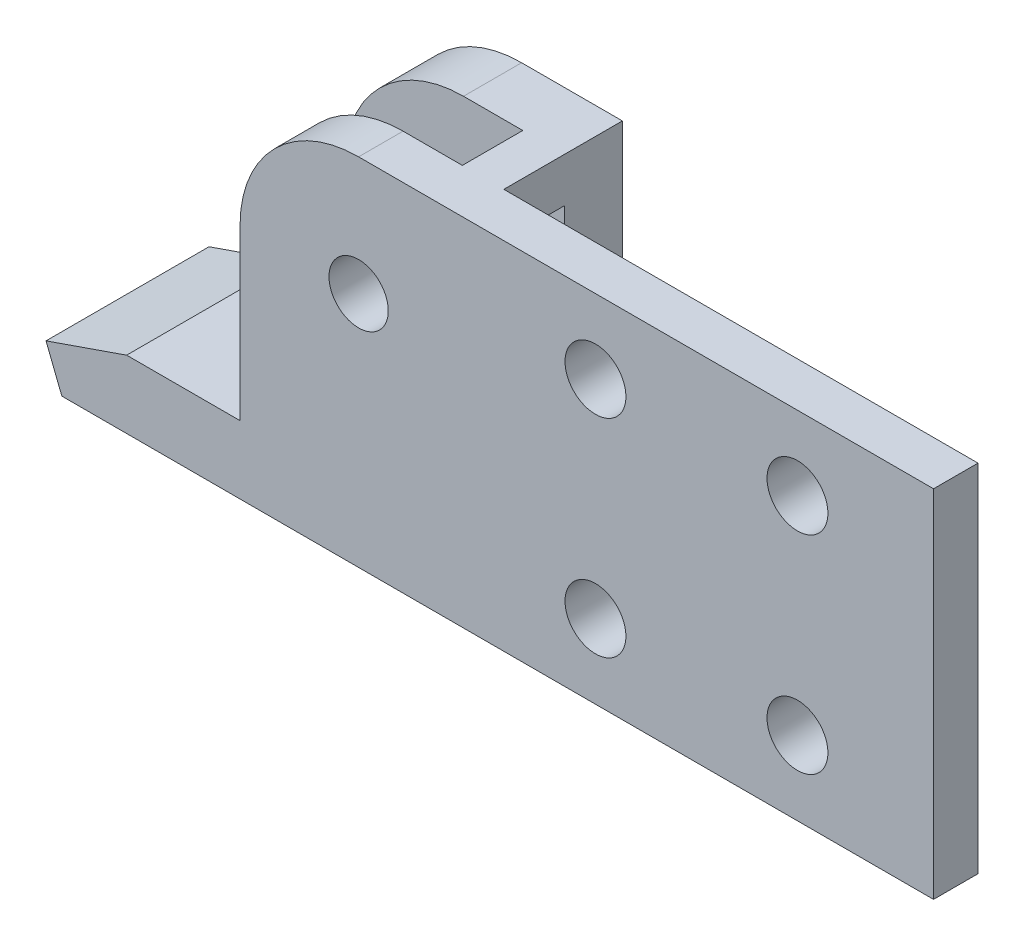
from build123d import *

# Parameters (mm, degrees)
SKETCH2_R                  = 3.175
BOSS_EXTRUDE1_DEPTH        = 4.7625
BOSS_EXTRUDE2_START        = 12.7
BOSS_EXTRUDE2_DEPTH        = 12.7
SKETCH12_W                 = 6.477
SKETCH12_H                 = 21.856650617
CUT_EXTRUDE1_DEPTH         = 24.13
SKETCH12_3_W               = 6.477
SKETCH12_3_H               = 4.7625
CUT_EXTRUDE2_DEPTH         = 19.05
TAP_DRILL_FOR_10_32_TAP1_D = 4.0386
F_1_4_CLEARANCE_HOLE1_D    = 6.5278


with BuildPart() as part:
    # Sketch2 → Boss-Extrude1 (new body)
    with BuildSketch(Plane.XY):
        with BuildLine():
            Line((-67.986186343, -228.533359856), (-69.686856366, -224.252380141))
            Line((-69.686856366, -224.252380141), (-61.0470258, -221.260552334))
            Line((-61.0470258, -221.260552334), (-48.895, -221.260552334))
            Line((-48.895, -221.260552334), (-48.895, -203.133359856))
            ThreePointArc((-48.895, -203.133359856), (-45.175256121, -194.153103735), (-36.195, -190.433359856))
            Line((-36.195, -190.433359856), (25.4, -190.433359856))
            Line((25.4, -190.433359856), (25.4, -228.533359856))
            Line((25.4, -228.533359856), (-67.986186343, -228.533359856))
        make_face()
        with Locations((-36.195, -203.133359856)):
            Circle(SKETCH2_R, mode=Mode.SUBTRACT)
    extrude(amount=BOSS_EXTRUDE1_DEPTH)

    # Sketch11 → Boss-Extrude2 (add)
    with BuildSketch(Plane(origin=(0, 0, 0), x_dir=(-1, 0, 0), z_dir=(0, 0, -1)).offset(BOSS_EXTRUDE2_START)):
        with BuildLine():
            Line((25.4, -190.433359856), (25.4, -228.533359856))
            Line((25.4, -228.533359856), (67.986186343, -228.533359856))
            Line((67.986186343, -228.533359856), (69.686856366, -224.252380141))
            Line((69.686856366, -224.252380141), (61.0470258, -221.260552334))
            Line((61.0470258, -221.260552334), (48.895, -221.260552334))
            Line((48.895, -221.260552334), (48.895, -203.133359856))
            ThreePointArc((48.895, -203.133359856), (45.175256121, -194.153103735), (36.195, -190.433359856))
            Line((36.195, -190.433359856), (25.4, -190.433359856))
        make_face()
    extrude(amount=-BOSS_EXTRUDE2_DEPTH)

    # Sketch12 → Cut-Extrude1 (cut)
    with BuildSketch(Plane.ZY.offset(48.895)):
        with Locations((-3.2385, -206.124185165)):
            Rectangle(SKETCH12_W, SKETCH12_H)
    extrude(amount=-CUT_EXTRUDE1_DEPTH, mode=Mode.SUBTRACT)

    # Sketch12<3> → Cut-Extrude2 (cut)
    with BuildSketch(Plane.ZY.offset(48.895)):
        with Locations((-3.2385, -192.814609856)):
            Rectangle(SKETCH12_3_W, SKETCH12_3_H)
    extrude(amount=-CUT_EXTRUDE2_DEPTH, mode=Mode.SUBTRACT)

    # Tap Drill for #10-32 Tap1 (through all)
    with Locations(Plane.XY.offset(-6.477)):
        with Locations((-36.195, -203.133359856)):
            Hole(TAP_DRILL_FOR_10_32_TAP1_D / 2)

    # 1/4 Clearance Hole1 (through all)
    with Locations(Plane.XY.offset(4.7625)):
        with Locations((-10.8204, -198.370859856), (-10.8204, -220.595859856), (10.8204, -220.595859856), (10.8204, -198.370859856)):
            Hole(F_1_4_CLEARANCE_HOLE1_D / 2)


solid = part.part
